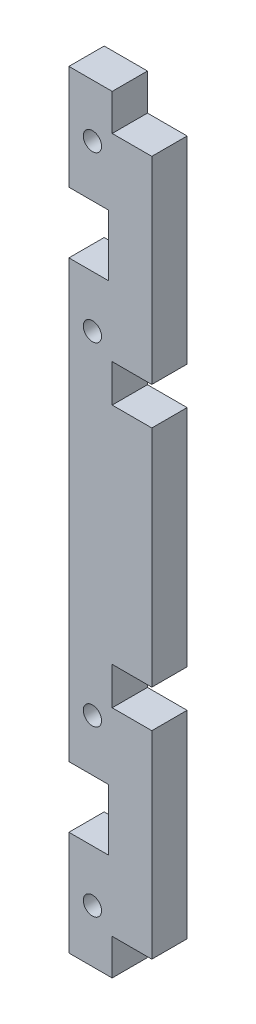
from build123d import *

# Parameters (mm, degrees)
SZKIC1_W                    = 14.1
SZKIC1_H                    = 136.58
DODANIE_WYCI_GNI_CIE1_DEPTH = 6
PRZENIE_CIAN_1_BY           = 6
SZKIC3_W                    = 6.75
SZKIC3_H                    = 10.4
SZKIC3_W_2                  = 6.95
SZKIC3_H_2                  = 6.4
SZKIC3_H_3                  = 6.342942851
WYTNIJ_WYCI_GNI_CIE1_DEPTH  = 107.058352026
SZKIC4_R                    = 1.55
WYTNIJ_WYCI_GNI_CIE2_DEPTH  = 107.058352026


with BuildPart() as part:
    # Szkic1 → Dodanie-wyciągnięcie1 (new body)
    with BuildSketch(Plane.XY):
        with Locations((-72.400450183, 1.710000001)):
            Rectangle(SZKIC1_W, SZKIC1_H)
    extrude(amount=-DODANIE_WYCI_GNI_CIE1_DEPTH)

    # Przenieś ścianę1: a face moved inward by 6.0
    extrude(part.faces().sort_by_distance((-72.400450183, -66.579999999, -3))[0], amount=PRZENIE_CIAN_1_BY, dir=(0, 1, 0), mode=Mode.SUBTRACT)

    # Szkic3 → Wytnij-wyciągnięcie1 (cut, through all)
    with BuildSketch(Plane.XY):
        with Locations((-76.075450183, 47.000000001)):
            Rectangle(SZKIC3_W, SZKIC3_H)
        with Locations((-76.075450183, -37.590311699)):
            Rectangle(SZKIC3_W, SZKIC3_H)
        with Locations((-68.613894602, 67.000000001)):
            Rectangle(SZKIC3_W_2, SZKIC3_H_2)
        with Locations((-68.613894602, 27.000000001)):
            Rectangle(SZKIC3_W_2, SZKIC3_H_2)
        with Locations((-68.625450183, -57.608528574)):
            Rectangle(SZKIC3_W_2, SZKIC3_H_3)
        with Locations((-68.613894602, -17.579999999)):
            Rectangle(SZKIC3_W_2, SZKIC3_H_2)
    extrude(amount=-WYTNIJ_WYCI_GNI_CIE1_DEPTH, mode=Mode.SUBTRACT)

    # Szkic4 → Wytnij-wyciągnięcie2 (cut, through all)
    with BuildSketch(Plane.XY):
        with Locations((-75.450450183, 61.000000001)):
            Circle(SZKIC4_R)
        with Locations((-75.450450183, -51.579999999)):
            Circle(SZKIC4_R)
        with Locations((-75.450450183, 33.000000001)):
            Circle(SZKIC4_R)
        with Locations((-75.450450183, -23.579999999)):
            Circle(SZKIC4_R)
    extrude(amount=-WYTNIJ_WYCI_GNI_CIE2_DEPTH, mode=Mode.SUBTRACT)


solid = part.part
